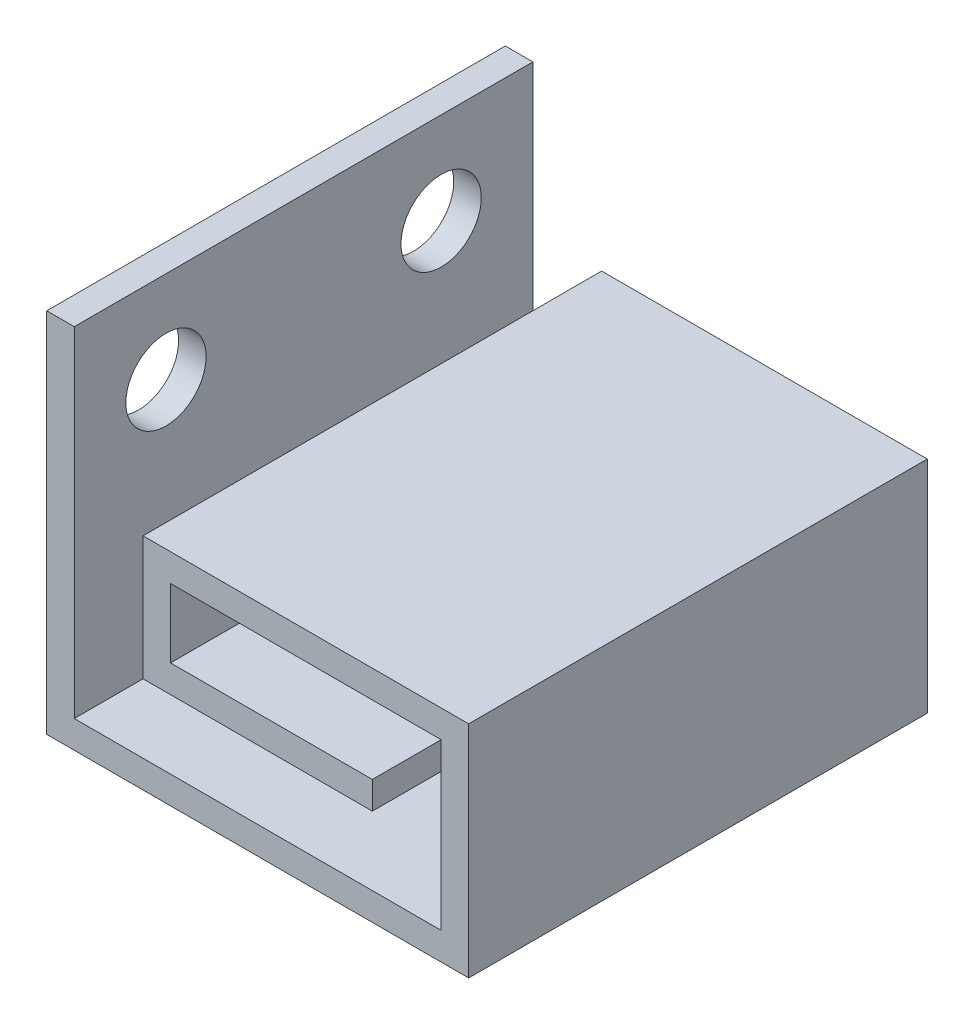
from build123d import *

# Parameters (mm, degrees)
BOSS_EXTRUDE1_DEPTH = 10
SKETCH2_R           = 1.75
CUT_EXTRUDE1_DEPTH  = 10


with BuildPart() as part:
    # Sketch1 → Boss-Extrude1 (new, symmetric)
    with BuildSketch(Plane.XY):
        Polygon((0, 0), (18.4, 0), (18.4, 9.6), (4.2, 9.6), (4.2, 4.2), (14.2, 4.2), (14.2, 5.4), (5.4, 5.4), (5.4, 8.4), (17.2, 8.4), (17.2, 1.2), (1.2, 1.2), (1.2, 16), (0, 16), align=None)
    extrude(amount=BOSS_EXTRUDE1_DEPTH, both=True)

    # Sketch2 → Cut-Extrude1 (cut, symmetric)
    with BuildSketch(Plane(origin=(1.2, 0, 0), x_dir=(0, 0, -1), z_dir=(1, 0, 0))):
        with Locations((-6, 12)):
            Circle(SKETCH2_R)
        with Locations((6, 12)):
            Circle(SKETCH2_R)
    extrude(amount=CUT_EXTRUDE1_DEPTH, both=True, mode=Mode.SUBTRACT)


solid = part.part
